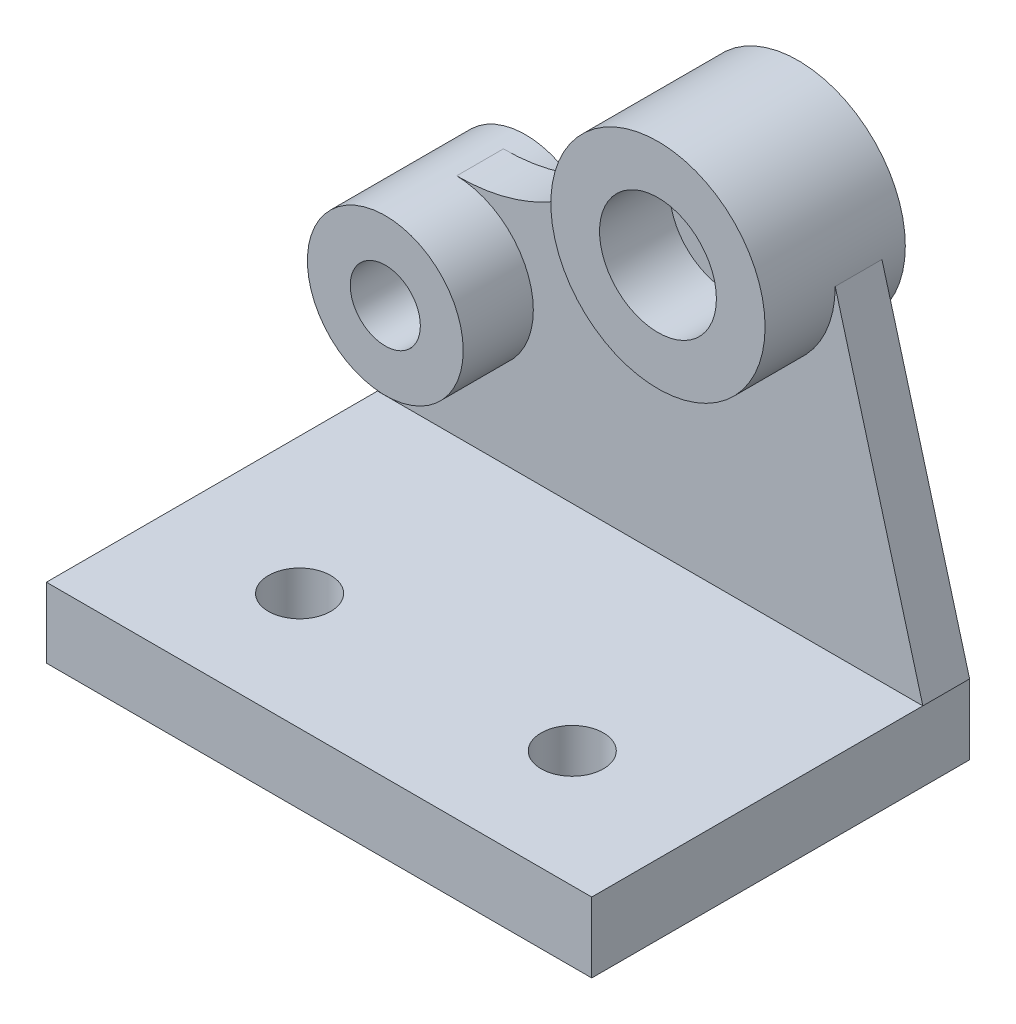
from build123d import *

# Parameters (mm, degrees)
SKETCH1_W           = 140
SKETCH1_H           = 18
BOSS_EXTRUDE1_DEPTH = 85
SKETCH3_R           = 8
CUT_EXTRUDE2_DEPTH  = 18
SKETCH5_W           = 140
SKETCH5_H           = 100
BOSS_EXTRUDE5_DEPTH = 12
SKETCH8_R           = 20
SKETCH8_R_2         = 9
SKETCH8_R_3         = 27.5
SKETCH8_R_4         = 15
BOSS_EXTRUDE6_DEPTH = 18
CUT_EXTRUDE3_DEPTH  = 12


with BuildPart() as part:
    # Sketch1 → Boss-Extrude1 (new body)
    with BuildSketch(Plane.XY):
        with Locations((70, 9)):
            Rectangle(SKETCH1_W, SKETCH1_H)
    extrude(amount=BOSS_EXTRUDE1_DEPTH)

    # Sketch3 → Cut-Extrude2 (cut)
    with BuildSketch(Plane(origin=(0, 18, 0), x_dir=(1, 0, 0), z_dir=(0, 1, 0))):
        with Locations(Location((35, -55, 0), (0, 0, 180))):
            Circle(SKETCH3_R)
        with Locations(Location((105, -55, 0), (0, 0, 180))):
            Circle(SKETCH3_R)
    extrude(amount=-CUT_EXTRUDE2_DEPTH, mode=Mode.SUBTRACT)

    # Sketch5 → Boss-Extrude5 (add)
    with BuildSketch(Plane(origin=(0, 0, 0), x_dir=(-1, 0, 0), z_dir=(0, 0, -1))):
        with Locations((-70, 50)):
            Rectangle(SKETCH5_W, SKETCH5_H)
    extrude(amount=BOSS_EXTRUDE5_DEPTH)

    # Sketch8 → Boss-Extrude6 (add, symmetric)
    # profile 1 of 2: a face of its own
    with BuildSketch(Plane.XY):
        with Locations(Location((20, 56, 0), (0, 0, 180))):
            Circle(SKETCH8_R)
        with Locations((20, 56)):
            Circle(SKETCH8_R_2, mode=Mode.SUBTRACT)
    # profile 2 of 2: a face of its own
    with BuildSketch(Plane.XY):
        with Locations((90, 100)):
            Circle(SKETCH8_R_3)
        with Locations((90, 100)):
            Circle(SKETCH8_R_4, mode=Mode.SUBTRACT)
    extrude(amount=BOSS_EXTRUDE6_DEPTH, both=True)

    # Sketch10 → Cut-Extrude3 (cut)
    with BuildSketch(Plane.XY):
        Polygon((117.5, 100), (140, 18), (140, 100), align=None)
        with BuildLine():
            ThreePointArc((20.315557315, 75.997510435), (44.612918998, 82.365712085), (62.5, 100))
            Line((62.5, 100), (0, 100))
            Line((0, 100), (0, 56))
            ThreePointArc((0, 56), (5.857864376, 70.142135624), (20, 76))
            ThreePointArc((20, 76), (20.157783568, 75.999377599), (20.315557315, 75.997510435))
        make_face()
    extrude(amount=-CUT_EXTRUDE3_DEPTH, mode=Mode.SUBTRACT)


solid = part.part
